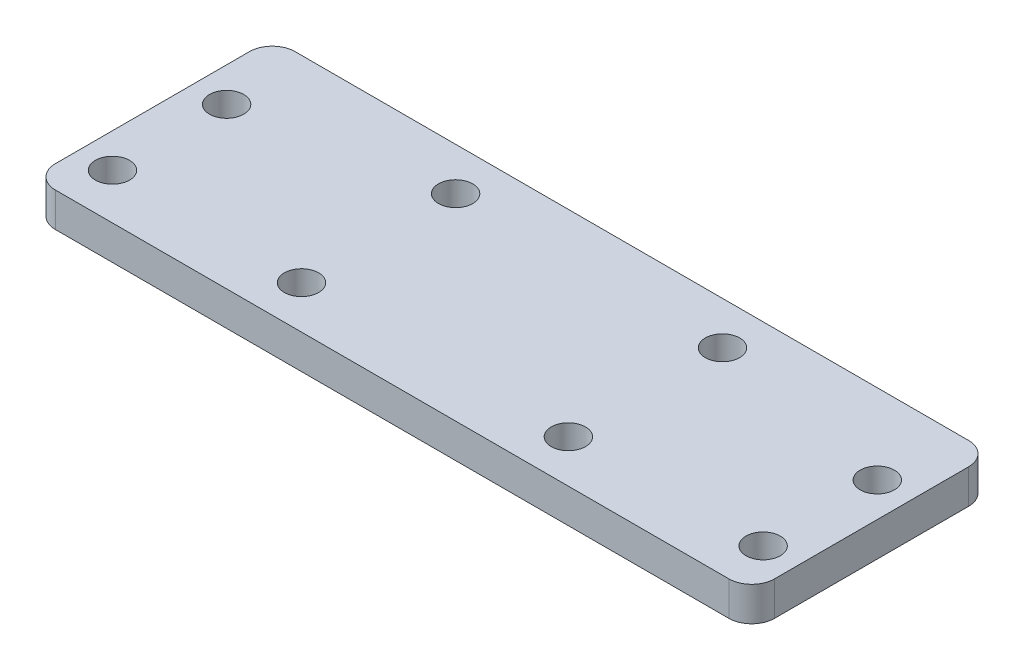
from build123d import *

# Parameters (mm, degrees)
SKETCH_1_W          = 63
SKETCH_1_H          = 21
SKETCH_1_R          = 1.5
EXTRUDE_1_DEPTH     = 3
FILLET_1_R          = 2
SKETCH_3_R          = 1.5
CUT_EXTRUDE_2_DEPTH = 34.339166156


with BuildPart() as part:
    # 草图1 → 凸台-拉伸1 (new body)
    with BuildSketch(Plane(origin=(0, 0, 0), x_dir=(1, 0, 0), z_dir=(0, 1, 0))):
        Rectangle(SKETCH_1_W, SKETCH_1_H)
        with Locations(Location((-11.69, 6.75, 0), (0, 0, 270))):
            Circle(SKETCH_1_R, mode=Mode.SUBTRACT)
        with Locations(Location((11.69, 6.75, 0), (0, 0, 270))):
            Circle(SKETCH_1_R, mode=Mode.SUBTRACT)
        with Locations(Location((11.69, -6.75, 0), (0, 0, 270))):
            Circle(SKETCH_1_R, mode=Mode.SUBTRACT)
        with Locations(Location((-11.69, -6.75, 0), (0, 0, 270))):
            Circle(SKETCH_1_R, mode=Mode.SUBTRACT)
    extrude(amount=EXTRUDE_1_DEPTH)

    # 圆角1
    fillet_1_edges = [part.edges().sort_by_distance(p)[0] for p in [
        (31.5, 1.5, 10.5),
        (-31.5, 1.5, 10.5),
        (-31.5, 1.5, -10.5),
        (31.5, 1.5, -10.5),
    ]]
    fillet(fillet_1_edges, radius=FILLET_1_R)

    # 草图3 → 切除-拉伸2 (cut, through all)
    with BuildSketch(Plane(origin=(0, 3, 0), x_dir=(1, 0, 0), z_dir=(0, 1, 0))):
        with Locations(Location((-28.5, -6.5, 0), (0, 0, 270))):
            Circle(SKETCH_3_R)
        with Locations(Location((-28.5, 3.5, 0), (0, 0, 270))):
            Circle(SKETCH_3_R)
        with Locations(Location((28.5, -6.5, 0), (0, 0, 90))):
            Circle(SKETCH_3_R)
        with Locations(Location((28.5, 3.5, 0), (0, 0, 90))):
            Circle(SKETCH_3_R)
    extrude(amount=-CUT_EXTRUDE_2_DEPTH, mode=Mode.SUBTRACT)


solid = part.part
